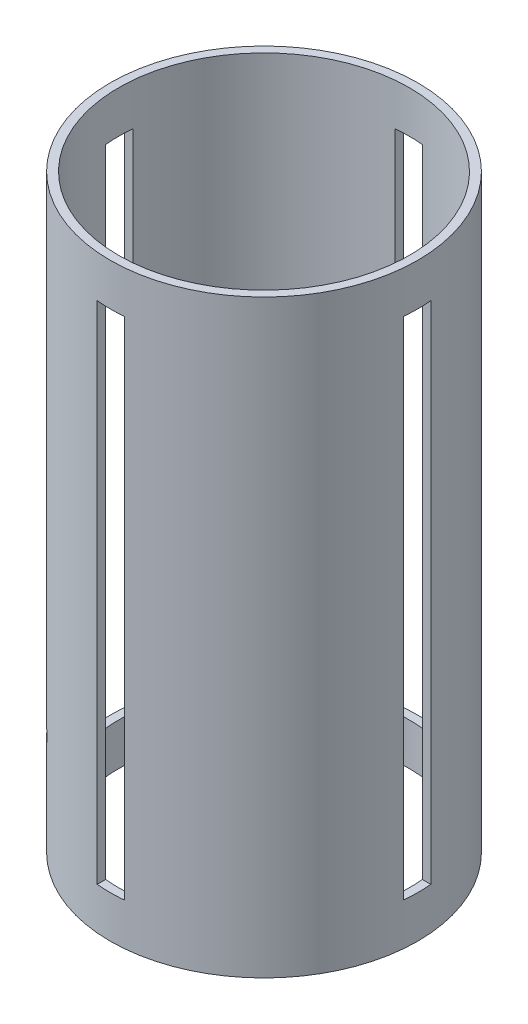
from build123d import *

# Parameters (mm, degrees)
SKETCH1_R           = 36.5
SKETCH1_R_2         = 34.5
BOSS_EXTRUDE1_DEPTH = 140
SKETCH3_W           = 6.5
SKETCH3_H           = 120
CUT_EXTRUDE1_DEPTH  = 150.212935096
CIRPATTERN1_COUNT   = 2
CIRPATTERN1_ANGLE   = 90
SKETCH4_R           = 2
CUT_EXTRUDE2_DEPTH  = 150.212935096


with BuildPart() as part:
    # Sketch1 → Boss-Extrude1 (new body)
    with BuildSketch(Plane(origin=(0, 0, 0), x_dir=(1, 0, 0), z_dir=(0, 1, 0))):
        Circle(SKETCH1_R)
        Circle(SKETCH1_R_2, mode=Mode.SUBTRACT)
    extrude(amount=BOSS_EXTRUDE1_DEPTH)

    # Sketch3 → Cut-Extrude1 (cut, symmetric)
    with BuildSketch(Plane.XY):
        with Locations((0, 70)):
            Rectangle(SKETCH3_W, SKETCH3_H)
    cut_extrude1 = extrude(amount=CUT_EXTRUDE1_DEPTH, both=True, mode=Mode.SUBTRACT)

    # CirPattern1: Cut-Extrude1 ×2 about axis
    cirpattern1_axis = Axis((0, 125, 0), (0, -1, 0))
    for i in range(1, CIRPATTERN1_COUNT):
        add(cut_extrude1.rotate(cirpattern1_axis, i * CIRPATTERN1_ANGLE / (CIRPATTERN1_COUNT - 1)), mode=Mode.SUBTRACT)

    # Sketch4 → Cut-Extrude2 (cut, through all)
    with BuildSketch(Plane(origin=(0, 0, 0), x_dir=(0.7071067811865477, 0, 0.7071067811865475), z_dir=(-0.7071067811865475, 0, 0.7071067811865477))):
        with Locations((0, 25)):
            Circle(SKETCH4_R)
    extrude(amount=CUT_EXTRUDE2_DEPTH, mode=Mode.SUBTRACT)


solid = part.part
